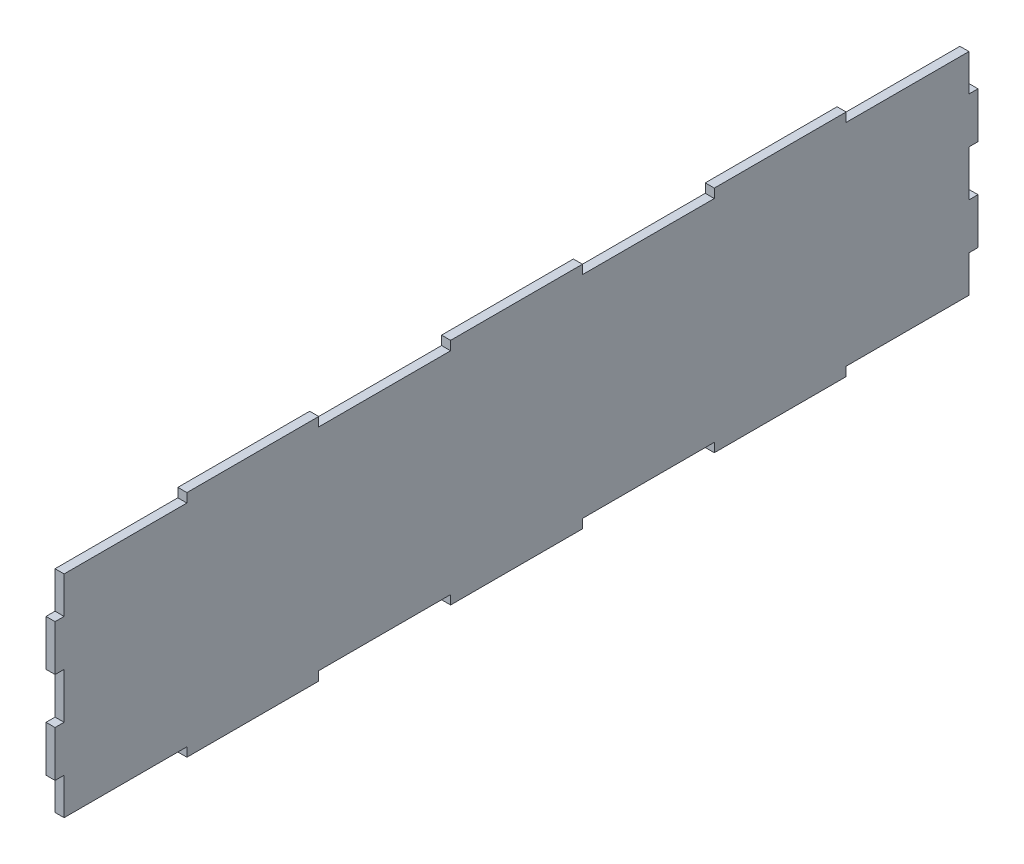
from build123d import *

# Parameters (mm, degrees)
BOSS_EXTRU_3_DEPTH = 3


with BuildPart() as part:
    # Esquisse3 → Boss.-Extru.3 (new body)
    with BuildSketch(Plane(origin=(0, 0, 0), x_dir=(0, 0, -1), z_dir=(1, 0, 0))):
        Polygon((109.285714286, 38), (65.571428571, 38), (65.571428571, 35), (21.857142857, 35), (21.857142857, 38), (-21.857142857, 38), (-21.857142857, 35), (-65.571428571, 35), (-65.571428571, 38), (-109.285714286, 38), (-109.285714286, 35), (-150, 35), (-150, 22.8), (-153, 22.8), (-153, 7.6), (-150, 7.6), (-150, -7.6), (-153, -7.6), (-153, -22.8), (-150, -22.8), (-150, -35), (-109.285714286, -35), (-109.285714286, -38), (-65.571428571, -38), (-65.571428571, -35), (-21.857142857, -35), (-21.857142857, -38), (21.857142857, -38), (21.857142857, -35), (65.571428571, -35), (65.571428571, -38), (109.285714286, -38), (109.285714286, -35), (150, -35), (150, -22.8), (153, -22.8), (153, -7.6), (150, -7.6), (150, 7.6), (153, 7.6), (153, 22.8), (150, 22.8), (150, 35), (109.285714286, 35), align=None)
    extrude(amount=BOSS_EXTRU_3_DEPTH)


solid = part.part
